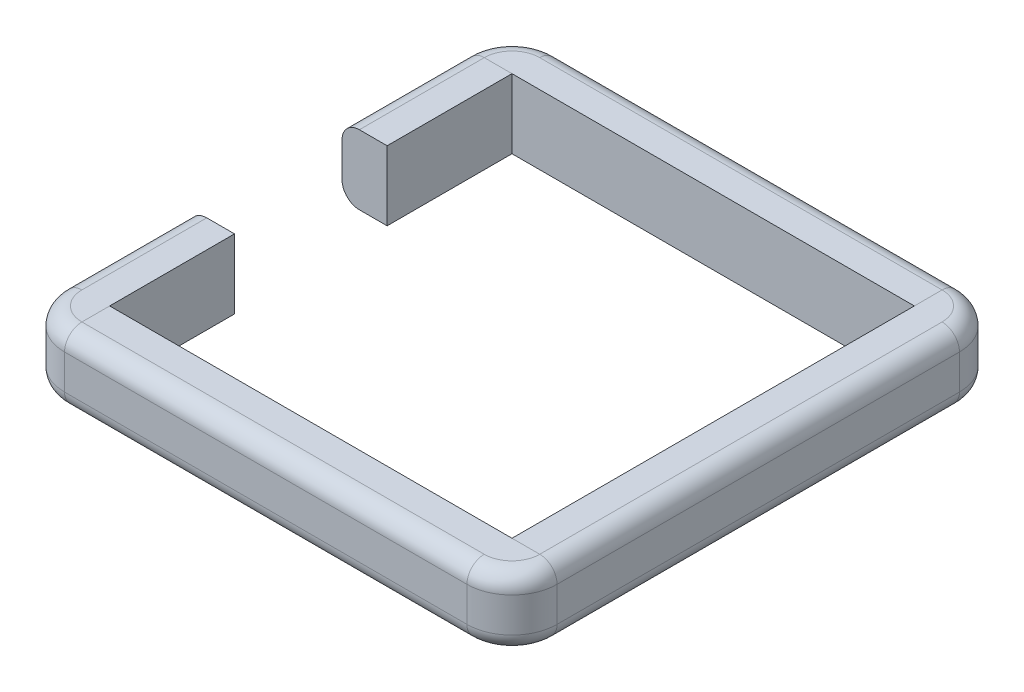
from build123d import *

# Parameters (mm, degrees)
BOSS_EXTRUDE1_DEPTH = 736.6
REVOLVE1_ANGLE      = 90
CIRPATTERN1_COUNT   = 4
SKETCH5_W           = 134.817252148
SKETCH5_H           = 279.4
CUT_EXTRUDE1_DEPTH  = 1202.644175771


with BuildPart() as part:
    # Sketch1 → Boss-Extrude1 (new body)
    with BuildSketch(Plane.XY):
        with BuildLine():
            ThreePointArc((0, 31.75), (-22.450640303, 22.450640303), (-31.75, 0))
            Line((-31.75, 0), (-31.75, -63.5))
            ThreePointArc((-31.75, -63.5), (-22.450640303, -85.950640303), (0, -95.25))
            Line((0, -95.25), (50.8, -95.25))
            Line((50.8, -95.25), (50.8, 31.75))
            Line((50.8, 31.75), (0, 31.75))
        make_face()
    extrude(amount=BOSS_EXTRUDE1_DEPTH)

    # Sketch2 → Revolve1 (revolve)
    with BuildSketch(Plane.XY.offset(736.6)):
        with BuildLine():
            Line((-31.75, 0), (-31.75, -63.5))
            ThreePointArc((-31.75, -63.5), (-22.450640303, -85.950640303), (0, -95.25))
            Line((0, -95.25), (50.8, -95.25))
            Line((50.8, -95.25), (50.8, 31.75))
            Line((50.8, 31.75), (0, 31.75))
            ThreePointArc((0, 31.75), (-22.450640303, 22.450640303), (-31.75, 0))
        make_face()
    revolve(axis=Axis((50.8, -95.25, 736.6), (0, 1, 0)), revolution_arc=REVOLVE1_ANGLE)


with BuildPart() as cirpattern1_1:
    # CirPattern1: pattern copy
    add(part.part.rotate(Axis((419.1, -95.25, 368.3), (0, 1, 0)), 1 * 360 / CIRPATTERN1_COUNT))


with BuildPart() as cirpattern1_2:
    # CirPattern1: pattern copy
    add(part.part.rotate(Axis((419.1, -95.25, 368.3), (0, 1, 0)), 2 * 360 / CIRPATTERN1_COUNT))


with BuildPart() as cirpattern1_3:
    # CirPattern1: pattern copy
    add(part.part.rotate(Axis((419.1, -95.25, 368.3), (0, 1, 0)), 3 * 360 / CIRPATTERN1_COUNT))


with BuildPart() as part_1:
    add(part.part)

    # Sketch5 → Cut-Extrude1 (cut, through all)
    with BuildSketch(Plane(origin=(0, 31.75, 0), x_dir=(1, 0, 0), z_dir=(0, 1, 0))):
        with Locations((-16.608626074, -368.3)):
            Rectangle(SKETCH5_W, SKETCH5_H)
    extrude(amount=-CUT_EXTRUDE1_DEPTH, mode=Mode.SUBTRACT)


with BuildPart() as cut_extrude1_piece_1:
    # of the separate pieces the step leaves, piece 1, a body of its own (cut_extrude1_pieces)
    add(part_1.part.solids().sort_by_distance((-31.75, 0, 508))[0])


with BuildPart() as cut_extrude1_piece_2:
    # of the separate pieces the step leaves, piece 2, a body of its own (cut_extrude1_pieces)
    add(part_1.part.solids().sort_by_distance((0, 31.75, 0))[0])


solid = Compound([cirpattern1_1.part, cirpattern1_2.part, cirpattern1_3.part, cut_extrude1_piece_1.part, cut_extrude1_piece_2.part])
